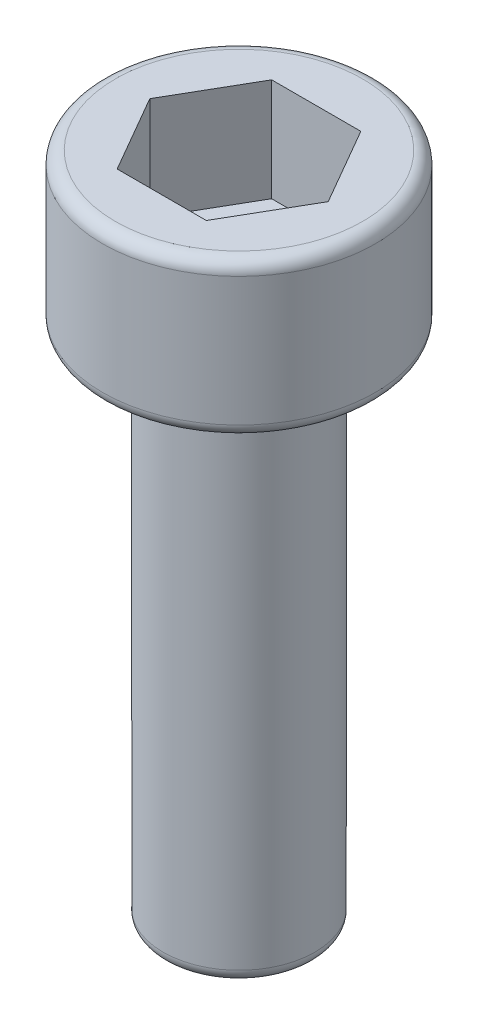
from build123d import *

# Parameters (mm, degrees)
SKETCH1_R           = 2.65
BOSS_EXTRUDE1_DEPTH = 3
SKETCH2_R           = 1.475
BOSS_EXTRUDE2_DEPTH = 10
FILLET1_R           = 0.25
CUT_EXTRUDE1_DEPTH  = 2


with BuildPart() as part:
    # Sketch1 → Boss-Extrude1 (new body)
    with BuildSketch(Plane(origin=(0, 0, 0), x_dir=(1, 0, 0), z_dir=(0, 1, 0))):
        with Locations(Location((0, 0, 0), (0, 0, 270))):
            Circle(SKETCH1_R)
    extrude(amount=BOSS_EXTRUDE1_DEPTH)

    # Sketch2 → Boss-Extrude2 (add)
    with BuildSketch(Plane.XZ):
        with Locations(Location((0, 0, 0), (0, 0, 90))):
            Circle(SKETCH2_R)
    extrude(amount=BOSS_EXTRUDE2_DEPTH)

    # Fillet1
    fillet1_edges = [part.edges().sort_by_distance(p)[0] for p in [
        (0, 0, -2.65),
        (0, 3, -2.65),
        (0, -10, -1.475),
    ]]
    fillet(fillet1_edges, radius=FILLET1_R)

    # Sketch3 → Cut-Extrude1 (cut)
    with BuildSketch(Plane(origin=(0, 3, 0), x_dir=(1, 0, 0), z_dir=(0, 1, 0))):
        Polygon((1.732050808, 0), (0.866025404, 1.5), (-0.866025404, 1.5), (-1.732050808, 0), (-0.866025404, -1.5), (0.866025404, -1.5), align=None)
    extrude(amount=-CUT_EXTRUDE1_DEPTH, mode=Mode.SUBTRACT)


solid = part.part
